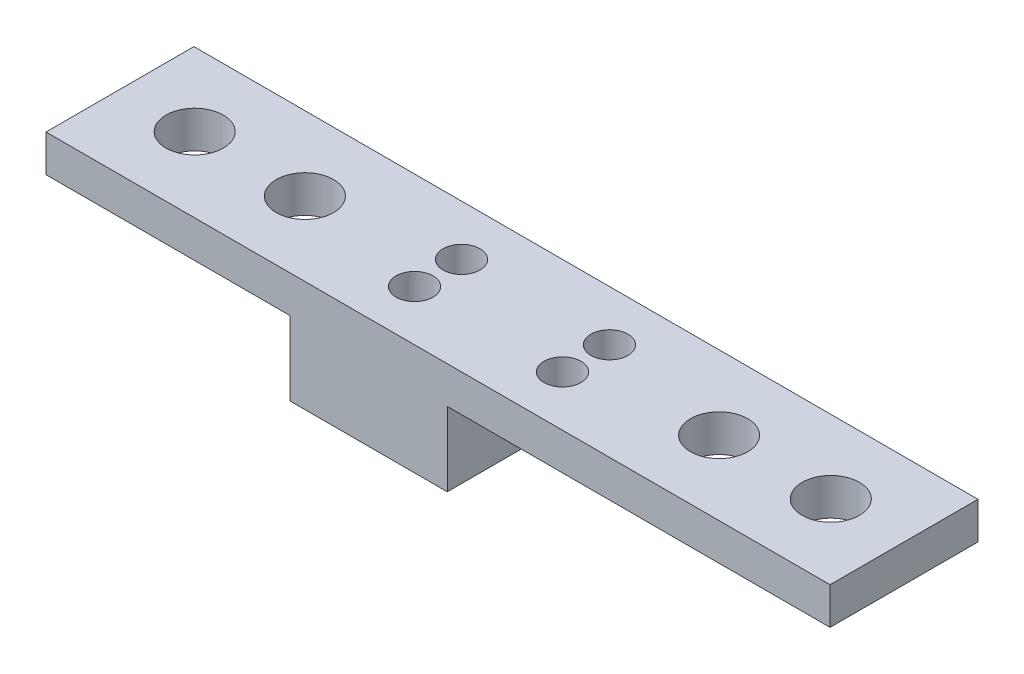
from build123d import *

# Parameters (mm, degrees)
SKETCH1_W           = 30.4
SKETCH1_H           = 8
SKETCH1_R           = 1.55
SKETCH1_R_2         = 1
BOSS_EXTRUDE1_DEPTH = 2
SKETCH3_W           = 1
SKETCH3_H           = 8
BOSS_EXTRUDE2_DEPTH = 4
BOSS_EXTRUDE3_START = 4
SKETCH4_W           = 7.5
SKETCH4_H           = 8
SKETCH4_R           = 1
BOSS_EXTRUDE3_DEPTH = 4
SKETCH6_W           = 6
SKETCH6_H           = 8
SKETCH6_R           = 1.55
BOSS_EXTRUDE4_DEPTH = 2


with BuildPart() as part:
    # Sketch1 → Boss-Extrude1 (new body)
    with BuildSketch(Plane(origin=(0, 0, 0), x_dir=(1, 0, 0), z_dir=(0, 1, 0))):
        Rectangle(SKETCH1_W, SKETCH1_H)
        with Locations(Location((-11.2, 0, 0), (0, 0, 270))):
            Circle(SKETCH1_R, mode=Mode.SUBTRACT)
        with Locations(Location((11.2, 0, 0), (0, 0, 90))):
            Circle(SKETCH1_R, mode=Mode.SUBTRACT)
        with Locations(Location((-4, 1.27, 0), (0, 0, 270))):
            Circle(SKETCH1_R_2, mode=Mode.SUBTRACT)
        with Locations(Location((-4, -1.27, 0), (0, 0, 270))):
            Circle(SKETCH1_R_2, mode=Mode.SUBTRACT)
        with Locations(Location((4, 1.27, 0), (0, 0, 270))):
            Circle(SKETCH1_R_2, mode=Mode.SUBTRACT)
        with Locations(Location((4, -1.27, 0), (0, 0, 270))):
            Circle(SKETCH1_R_2, mode=Mode.SUBTRACT)
    extrude(amount=BOSS_EXTRUDE1_DEPTH)

    # Sketch3 → Boss-Extrude2 (add)
    with BuildSketch(Plane.XZ):
        Rectangle(SKETCH3_W, SKETCH3_H)
    extrude(amount=BOSS_EXTRUDE2_DEPTH)

    # Sketch4 → Boss-Extrude3 (add)
    with BuildSketch(Plane.XZ.offset(BOSS_EXTRUDE3_START)):
        with Locations((-4.25, 0)):
            Rectangle(SKETCH4_W, SKETCH4_H)
        with Locations(Location((-4, 1.27, 0), (0, 0, 90))):
            Circle(SKETCH4_R, mode=Mode.SUBTRACT)
        with Locations(Location((-4, -1.27, 0), (0, 0, 90))):
            Circle(SKETCH4_R, mode=Mode.SUBTRACT)
    extrude(amount=-BOSS_EXTRUDE3_DEPTH)

    # Sketch6 → Boss-Extrude4 (add)
    # profile 1 of 2: a face of its own
    with BuildSketch(Plane(origin=(0, 2, 0), x_dir=(1, 0, 0), z_dir=(0, 1, 0))):
        with Locations((-18.2, 0)):
            Rectangle(SKETCH6_W, SKETCH6_H)
        with Locations(Location((-17.2, 0.040141274, 0), (0, 0, 270))):
            Circle(SKETCH6_R, mode=Mode.SUBTRACT)
    # profile 2 of 2: a face of its own
    with BuildSketch(Plane(origin=(0, 2, 0), x_dir=(1, 0, 0), z_dir=(0, 1, 0))):
        with Locations((18.2, 0)):
            Rectangle(SKETCH6_W, SKETCH6_H)
        with Locations(Location((17.2, 0.040141274, 0), (0, 0, 270))):
            Circle(SKETCH6_R, mode=Mode.SUBTRACT)
    extrude(amount=-BOSS_EXTRUDE4_DEPTH)


solid = part.part
